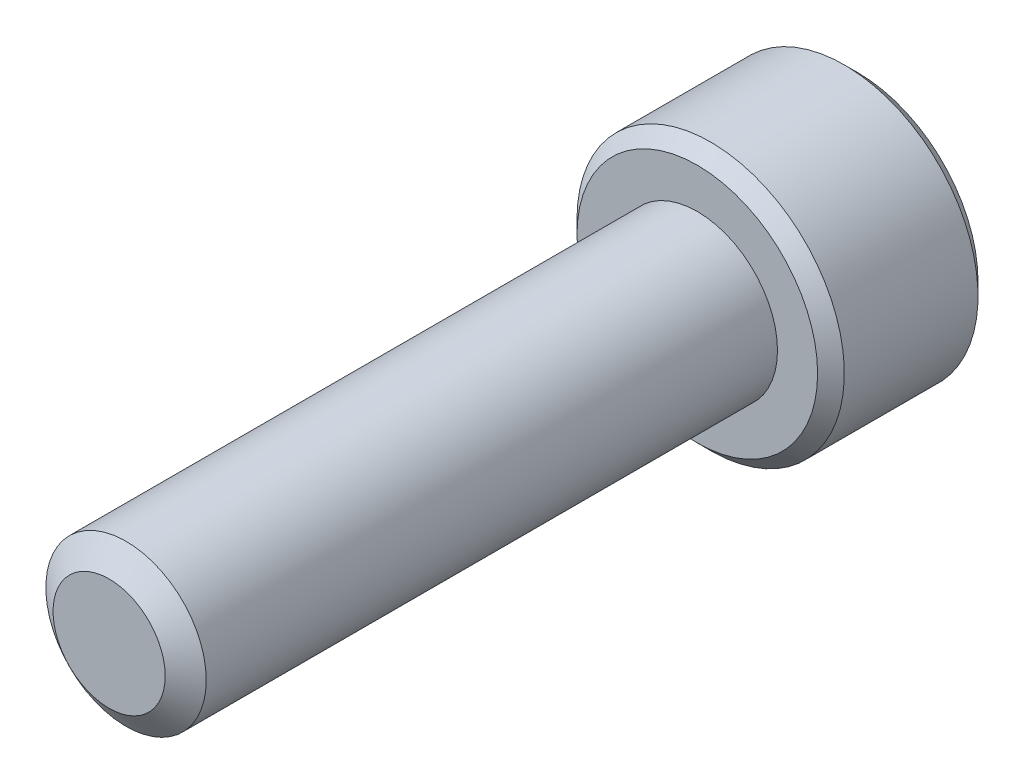
from build123d import *

# Parameters (mm, degrees)
SKETCH1_R          = 3
EXTRUDE1_DEPTH     = 22
SKETCH6_R          = 5
EXTRUDE2_DEPTH     = 6
CUT_EXTRUDE1_DEPTH = 3.75
CHAMFER1_SIZE      = 0.5


with BuildPart() as part:
    # Sketch1 → Extrude1 (new body)
    with BuildSketch(Plane.XY):
        Circle(SKETCH1_R)
    extrude(amount=-EXTRUDE1_DEPTH)

    # Sketch4 → Cut-Revolve1 (revolve, cut)
    with BuildSketch(Plane(origin=(0, 0, 0), x_dir=(0, 0, -1), z_dir=(1, 0, 0))):
        Polygon((0.632650852, 3), (0, 2.096480947), (0, 3), align=None)
    revolve(axis=Axis((0, 0, 0), (0, 0, -1)), mode=Mode.SUBTRACT)

    # Sketch6 → Extrude2 (add)
    with BuildSketch(Plane(origin=(0, 0, -22), x_dir=(-1, 0, 0), z_dir=(0, 0, -1))):
        Circle(SKETCH6_R)
    extrude(amount=EXTRUDE2_DEPTH)

    # Sketch7 → Cut-Extrude1 (cut)
    with BuildSketch(Plane(origin=(0, 0, -28), x_dir=(-1, 0, 0), z_dir=(0, 0, -1))):
        Polygon((0, 2.886751346), (-2.5, 1.443375673), (-2.5, -1.443375673), (0, -2.886751346), (2.5, -1.443375673), (2.5, 1.443375673), align=None)
    extrude(amount=-CUT_EXTRUDE1_DEPTH, mode=Mode.SUBTRACT)

    # Chamfer1
    chamfer1_edges = [part.edges().sort_by_distance(p)[0] for p in [
        (5, 0, -28),
        (5, 0, -22),
    ]]
    chamfer(chamfer1_edges, length=CHAMFER1_SIZE)


solid = part.part
